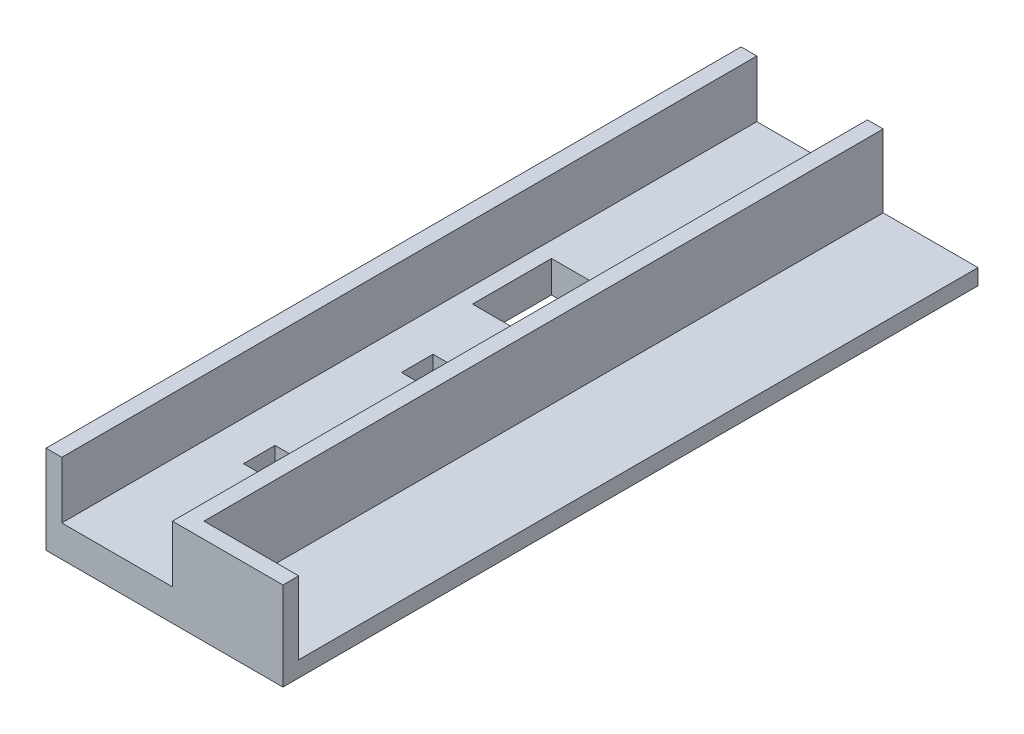
from build123d import *

# Parameters (mm, degrees)
DODANIE_WYCI_GNI_CIE1_DEPTH = 220
SZKIC4_W                    = 30
SZKIC4_H                    = 23
DODANIE_WYCI_GNI_CIE3_DEPTH = 5
SZKIC5_W                    = 10
SZKIC5_H                    = 10
SZKIC5_W_2                  = 25
SZKIC5_H_2                  = 25
WYTNIJ_WYCI_GNI_CIE1_DEPTH  = 25


with BuildPart() as part:
    # Szkic1 → Dodanie-wyciągnięcie1 (new body)
    with BuildSketch(Plane.XY):
        Polygon((-22.5, -10), (52.5, -10), (52.5, -5), (22.5, -5), (22.5, 18), (17.5, 18), (17.5, 0), (-17.5, 0), (-17.5, 18), (-22.5, 18), align=None)
    extrude(amount=-DODANIE_WYCI_GNI_CIE1_DEPTH)

    # Szkic4 → Dodanie-wyciągnięcie3 (add)
    with BuildSketch(Plane.XY):
        with Locations((37.5, 6.5)):
            Rectangle(SZKIC4_W, SZKIC4_H)
    extrude(amount=-DODANIE_WYCI_GNI_CIE3_DEPTH)

    # Szkic5 → Wytnij-wyciągnięcie1 (cut)
    with BuildSketch(Plane(origin=(0, 0, 0), x_dir=(1, 0, 0), z_dir=(0, 1, 0))):
        with Locations((0, 50)):
            Rectangle(SZKIC5_W, SZKIC5_H)
        with Locations((0, 100)):
            Rectangle(SZKIC5_W, SZKIC5_H)
        with Locations((0, 137.5)):
            Rectangle(SZKIC5_W_2, SZKIC5_H_2)
    extrude(amount=-WYTNIJ_WYCI_GNI_CIE1_DEPTH, mode=Mode.SUBTRACT)


solid = part.part
